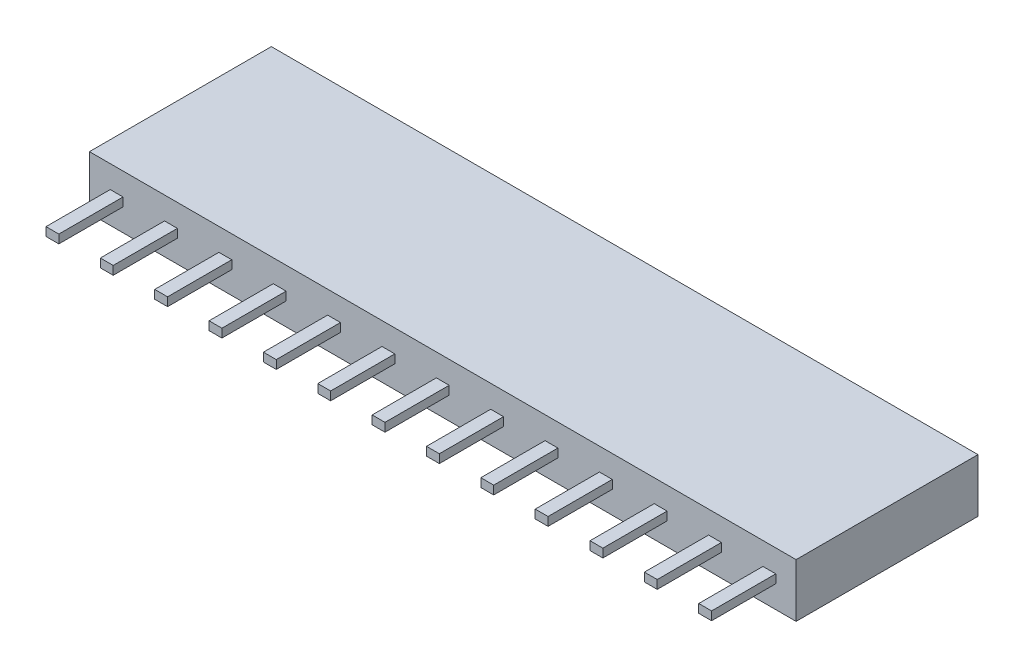
from build123d import *

# Parameters (mm, degrees)
SKETCH_1_W      = 33.02
SKETCH_1_H      = 8.5
EXTRUDE_1_DEPTH = 2.5
SKETCH_2_W      = 0.6
SKETCH_2_H      = 0.4
EXTRUDE_2_DEPTH = 3


with BuildPart() as part:
    # Эскиз1 → Бобышка-Вытянуть1 (new body)
    with BuildSketch(Plane(origin=(0, 0, 0), x_dir=(1, 0, 0), z_dir=(0, 1, 0))):
        Rectangle(SKETCH_1_W, SKETCH_1_H)
    extrude(amount=EXTRUDE_1_DEPTH)

    # Эскиз2 → Бобышка-Вытянуть2 (add)
    with BuildSketch(Plane.XY.offset(4.25)):
        with Locations((-7.62, 1.25)):
            Rectangle(SKETCH_2_W, SKETCH_2_H)
        with Locations((-10.16, 1.25)):
            Rectangle(SKETCH_2_W, SKETCH_2_H)
        with Locations((-5.08, 1.25)):
            Rectangle(SKETCH_2_W, SKETCH_2_H)
        with Locations((-2.54, 1.25)):
            Rectangle(SKETCH_2_W, SKETCH_2_H)
        with Locations((0, 1.25)):
            Rectangle(SKETCH_2_W, SKETCH_2_H)
        with Locations((2.54, 1.25)):
            Rectangle(SKETCH_2_W, SKETCH_2_H)
        with Locations((5.08, 1.25)):
            Rectangle(SKETCH_2_W, SKETCH_2_H)
        with Locations((7.62, 1.25)):
            Rectangle(SKETCH_2_W, SKETCH_2_H)
        with Locations((10.180976984, 1.25)):
            Rectangle(SKETCH_2_W, SKETCH_2_H)
        with Locations((12.720976984, 1.25)):
            Rectangle(SKETCH_2_W, SKETCH_2_H)
        with Locations((15.260976984, 1.25)):
            Rectangle(SKETCH_2_W, SKETCH_2_H)
        with Locations((-12.7, 1.25)):
            Rectangle(SKETCH_2_W, SKETCH_2_H)
        with Locations((-15.24, 1.25)):
            Rectangle(SKETCH_2_W, SKETCH_2_H)
    extrude(amount=EXTRUDE_2_DEPTH)


solid = part.part
